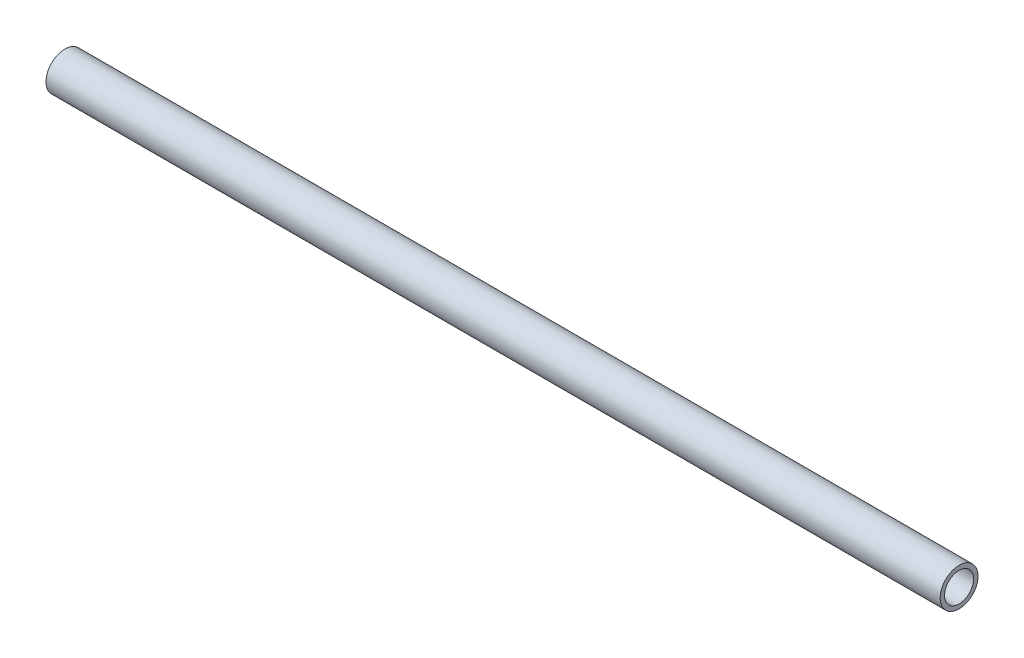
from build123d import *

# Parameters (mm, degrees)
BOSS_EXTRUDE1_DEPTH      = 149.906158
BOSS_EXTRUDE1_DEPTH_BACK = 149.906158
SKETCH1_R                = 6.35
SKETCH1_R_2              = 4.8768


with BuildPart() as part:
    # Sketch1 → Boss-Extrude1 (new, two sides: drawn at the far end of the back side and taken through both)
    with BuildSketch(Plane(origin=(0, 0, 0), x_dir=(0, 0, -1), z_dir=(1, 0, 0)).offset(-BOSS_EXTRUDE1_DEPTH_BACK)):
        with Locations(Location((0, 0, 0), (0, 0, 180))):
            Circle(SKETCH1_R)
        with Locations(Location((0, 0, 0), (0, 0, 180))):
            Circle(SKETCH1_R_2, mode=Mode.SUBTRACT)
    extrude(amount=BOSS_EXTRUDE1_DEPTH + BOSS_EXTRUDE1_DEPTH_BACK)


solid = part.part
